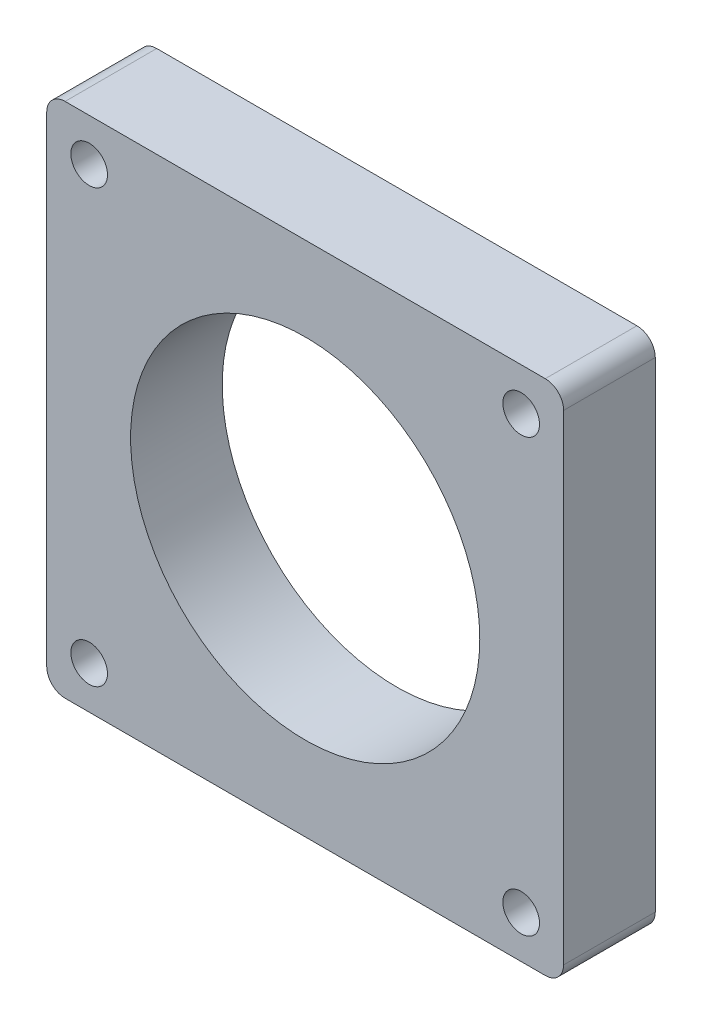
from build123d import *

# Parameters (mm, degrees)
ESQUISSE1_W             = 56.4
ESQUISSE1_H             = 56.4
ESQUISSE1_R             = 2
BOSS_EXTRU_1_DEPTH      = 10
ESQUISSE2_R             = 19.05
ENL_V_MAT_EXTRU_1_DEPTH = 10
CONG_1_R                = 2


with BuildPart() as part:
    # Esquisse1 → Boss.-Extru.1 (new body)
    with BuildSketch(Plane.XY):
        Rectangle(ESQUISSE1_W, ESQUISSE1_H)
        with Locations((23.57, 23.57)):
            Circle(ESQUISSE1_R, mode=Mode.SUBTRACT)
        with Locations(Location((-23.57, 23.57, 0), (0, 0, 180))):
            Circle(ESQUISSE1_R, mode=Mode.SUBTRACT)
        with Locations(Location((23.57, -23.57, 0), (0, 0, 180))):
            Circle(ESQUISSE1_R, mode=Mode.SUBTRACT)
        with Locations((-23.57, -23.57)):
            Circle(ESQUISSE1_R, mode=Mode.SUBTRACT)
    extrude(amount=BOSS_EXTRU_1_DEPTH)

    # Esquisse2 → Enlèv. mat.-Extru.1 (cut)
    with BuildSketch(Plane.XY.offset(10)):
        Circle(ESQUISSE2_R)
    extrude(amount=-ENL_V_MAT_EXTRU_1_DEPTH, mode=Mode.SUBTRACT)

    # Congé1
    cong_1_edges = [part.edges().sort_by_distance(p)[0] for p in [
        (28.2, -28.2, 5),
        (-28.2, -28.2, 5),
        (-28.2, 28.2, 5),
        (28.2, 28.2, 5),
    ]]
    fillet(cong_1_edges, radius=CONG_1_R)


solid = part.part
